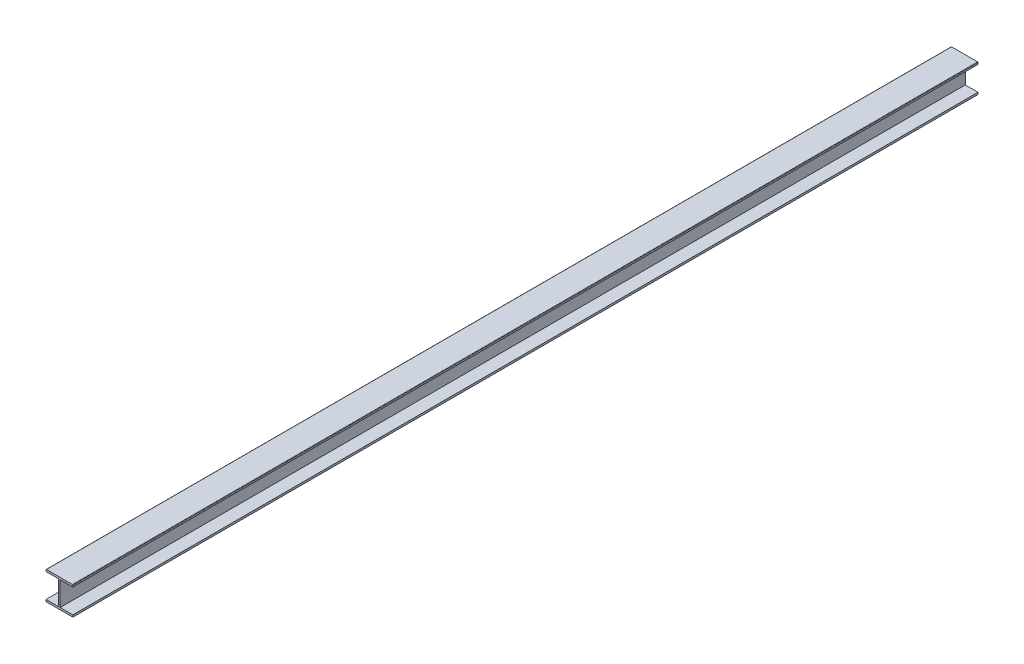
from build123d import *

# Parameters (mm, degrees)
BOSS_EXTRUDE1_DEPTH = 5214.4
FILLET1_R           = 2.54


with BuildPart() as part:
    # Sketch1 → Boss-Extrude1 (new body)
    with BuildSketch(Plane.XY):
        Polygon((0, -0.000240533), (154.432, -0.000240533), (154.432, -11.557240533), (81.28, -11.557240533), (81.28, -150.495240533), (154.432, -150.495240533), (154.432, -162.052240533), (0, -162.052240533), (0, -150.495240533), (73.152, -150.495240533), (73.152, -11.557240533), (0, -11.557240533), align=None)
    extrude(amount=BOSS_EXTRUDE1_DEPTH)

    # Fillet1
    fillet1_edges = [part.edges().sort_by_distance(p)[0] for p in [
        (0, -0.000240533, 2607.2),
        (154.432, -0.000240533, 2607.2),
    ]]
    fillet(fillet1_edges, radius=FILLET1_R)


solid = part.part
